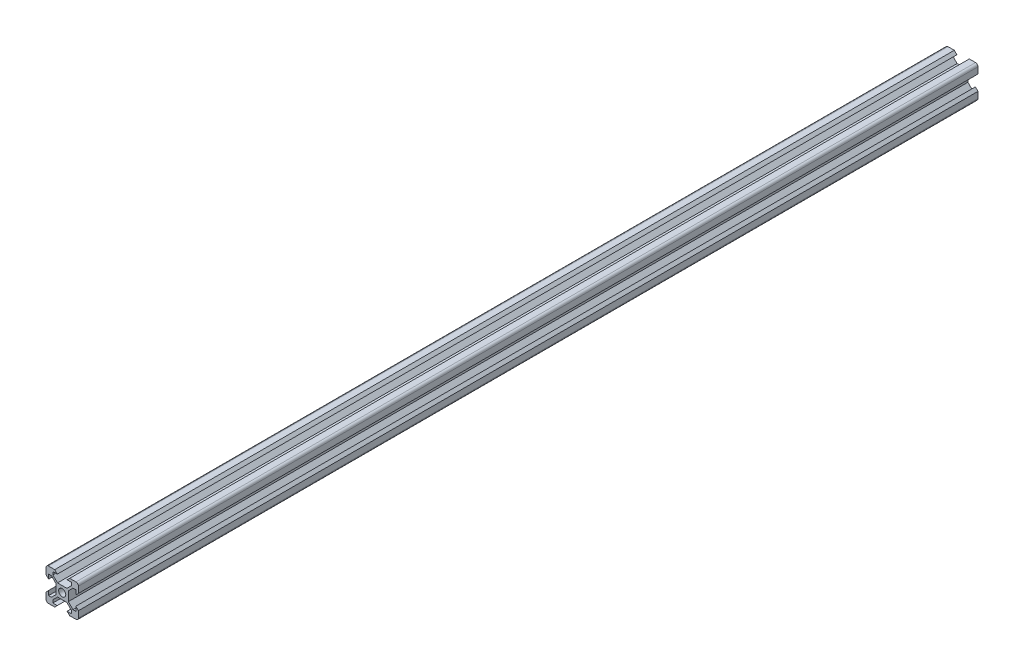
from build123d import *

# Parameters (mm, degrees)
SKETCH1_W           = 15.088
SKETCH1_H           = 15.088
SKETCH1_R           = 4.4
BOSS_EXTRUDE1_DEPTH = 555


with BuildPart() as part:
    # Sketch1 → Boss-Extrude1 (new, symmetric)
    # profile 1 of 5: a face of its own
    with BuildSketch(Plane.XY):
        with BuildLine():
            Line((-7.544, 7.544), (-5.784718328, 7.544))
            Line((-5.784718328, 7.544), (-11.512, 13.271281672))
            Line((-11.512, 13.271281672), (-11.512, 16.8))
            Line((-11.512, 16.8), (-6.051976926, 16.8))
            Line((-6.051976926, 16.8), (-9.251976926, 20))
            Line((-9.251976926, 20), (-17, 20))
            ThreePointArc((-17, 20), (-19.121320344, 19.121320344), (-20, 17))
            Line((-20, 17), (-20, 9.251976926))
            Line((-20, 9.251976926), (-16.8, 6.051976926))
            Line((-16.8, 6.051976926), (-16.8, 11.512))
            Line((-16.8, 11.512), (-13.271281672, 11.512))
            Line((-13.271281672, 11.512), (-7.544, 5.784718328))
            Line((-7.544, 5.784718328), (-7.544, 7.544))
        make_face()
    # profile 2 of 5: a face of its own
    with BuildSketch(Plane.XY):
        with BuildLine():
            Line((11.512, 13.271281672), (5.784718328, 7.544))
            Line((5.784718328, 7.544), (7.544, 7.544))
            Line((7.544, 7.544), (7.544, 5.784718328))
            Line((7.544, 5.784718328), (13.271281672, 11.512))
            Line((13.271281672, 11.512), (16.8, 11.512))
            Line((16.8, 11.512), (16.8, 6.051976926))
            Line((16.8, 6.051976926), (20, 9.251976926))
            Line((20, 9.251976926), (20, 17))
            ThreePointArc((20, 17), (19.121320344, 19.121320344), (17, 20))
            Line((17, 20), (9.251976926, 20))
            Line((9.251976926, 20), (6.051976926, 16.8))
            Line((6.051976926, 16.8), (11.512, 16.8))
            Line((11.512, 16.8), (11.512, 13.271281672))
        make_face()
    # profile 3 of 5: a face of its own
    with BuildSketch(Plane.XY):
        with BuildLine():
            Line((-7.544, -7.544), (-7.544, -5.784718328))
            Line((-7.544, -5.784718328), (-13.271281672, -11.512))
            Line((-13.271281672, -11.512), (-16.8, -11.512))
            Line((-16.8, -11.512), (-16.8, -6.051976926))
            Line((-16.8, -6.051976926), (-20, -9.251976926))
            Line((-20, -9.251976926), (-20, -17))
            ThreePointArc((-20, -17), (-19.121320344, -19.121320344), (-17, -20))
            Line((-17, -20), (-9.251976926, -20))
            Line((-9.251976926, -20), (-6.051976926, -16.8))
            Line((-6.051976926, -16.8), (-11.512, -16.8))
            Line((-11.512, -16.8), (-11.512, -13.271281672))
            Line((-11.512, -13.271281672), (-5.784718328, -7.544))
            Line((-5.784718328, -7.544), (-7.544, -7.544))
        make_face()
    # profile 4 of 5: a face of its own
    with BuildSketch(Plane.XY):
        with BuildLine():
            Line((13.271281672, -11.512), (7.544, -5.784718328))
            Line((7.544, -5.784718328), (7.544, -7.544))
            Line((7.544, -7.544), (5.784718328, -7.544))
            Line((5.784718328, -7.544), (11.512, -13.271281672))
            Line((11.512, -13.271281672), (11.512, -16.8))
            Line((11.512, -16.8), (6.051976926, -16.8))
            Line((6.051976926, -16.8), (9.251976926, -20))
            Line((9.251976926, -20), (17, -20))
            ThreePointArc((17, -20), (19.121320344, -19.121320344), (20, -17))
            Line((20, -17), (20, -9.251976926))
            Line((20, -9.251976926), (16.8, -6.051976926))
            Line((16.8, -6.051976926), (16.8, -11.512))
            Line((16.8, -11.512), (13.271281672, -11.512))
        make_face()
    # profile 5 of 5: a face of its own
    with BuildSketch(Plane.XY):
        Rectangle(SKETCH1_W, SKETCH1_H)
        Circle(SKETCH1_R, mode=Mode.SUBTRACT)
    extrude(amount=BOSS_EXTRUDE1_DEPTH, both=True)


solid = part.part
